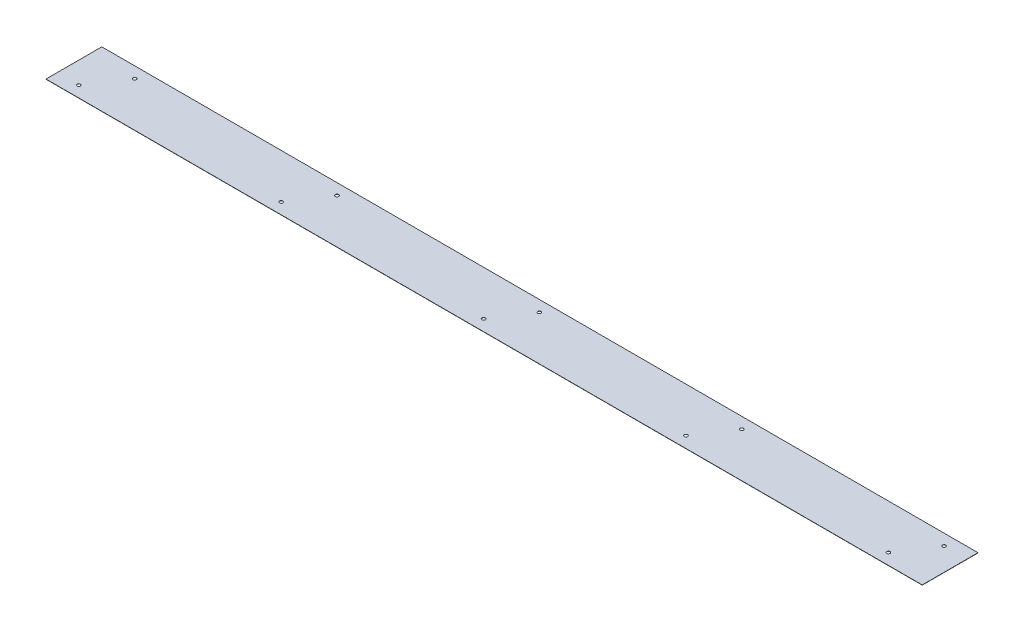
from build123d import *

# Parameters (mm, degrees)
SKETCH1_W               = 785.4
SKETCH1_H               = 50
BOSS_EXTRUDE1_DEPTH     = 0.2
CUT_EXTRUDE1_DEPTH      = 0.2
CUT_EXTRUDE1_DEPTH_BACK = 0.2
SKETCH2_R               = 1.5


with BuildPart() as part:
    # Sketch1 → Boss-Extrude1 (new body)
    with BuildSketch(Plane(origin=(0, 0, 0), x_dir=(1, 0, 0), z_dir=(0, 1, 0))):
        with Locations((392.7, 25)):
            Rectangle(SKETCH1_W, SKETCH1_H)
    extrude(amount=BOSS_EXTRUDE1_DEPTH)

    # Sketch2 → Cut-Extrude1 (cut, two sides: drawn at the far end of the back side and taken through both)
    with BuildSketch(Plane(origin=(0, 0, 0), x_dir=(1, 0, 0), z_dir=(0, 1, 0)).offset(-CUT_EXTRUDE1_DEPTH_BACK)):
        with Locations((19.437732804, 10)):
            Circle(SKETCH2_R)
        with Locations((39.437732804, 40)):
            Circle(SKETCH2_R)
        with Locations((200.837732804, 10)):
            Circle(SKETCH2_R)
        with Locations((220.837732804, 40)):
            Circle(SKETCH2_R)
        with Locations((382.237732804, 10)):
            Circle(SKETCH2_R)
        with Locations((402.237732804, 40)):
            Circle(SKETCH2_R)
        with Locations((563.637732804, 10)):
            Circle(SKETCH2_R)
        with Locations((583.637732804, 40)):
            Circle(SKETCH2_R)
        with Locations((745.037732804, 10)):
            Circle(SKETCH2_R)
        with Locations((765.037732804, 40)):
            Circle(SKETCH2_R)
    extrude(amount=CUT_EXTRUDE1_DEPTH + CUT_EXTRUDE1_DEPTH_BACK, mode=Mode.SUBTRACT)


solid = part.part
